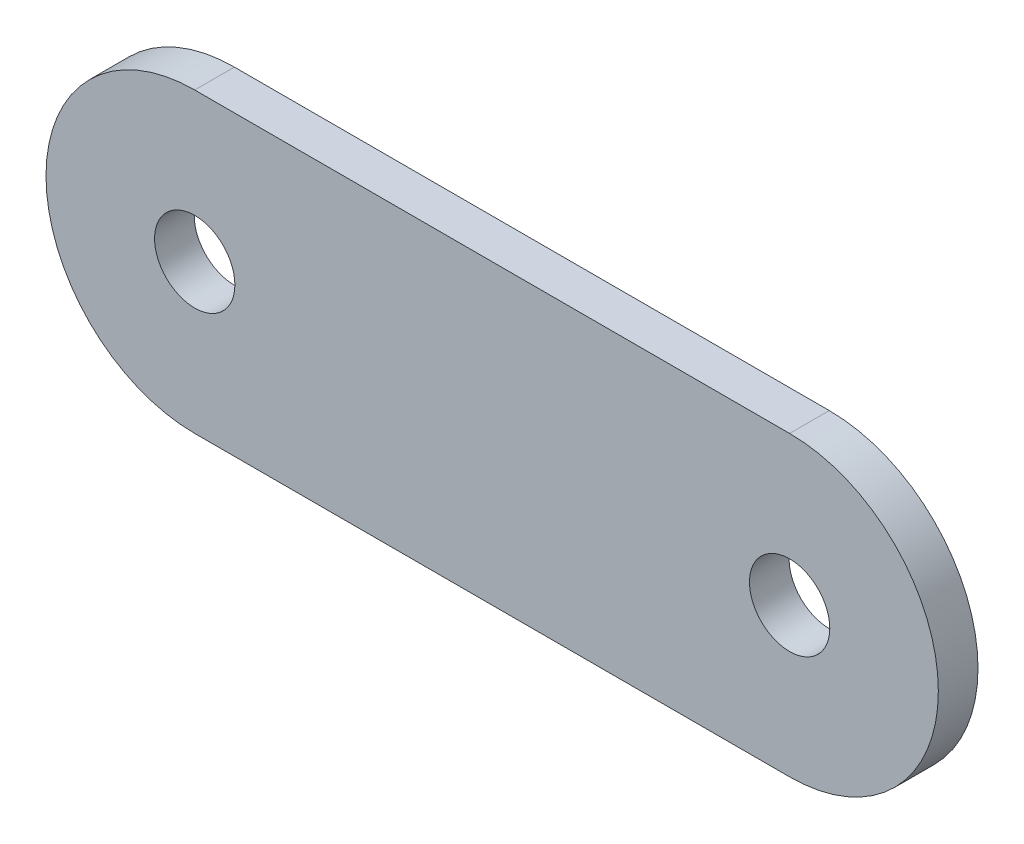
from build123d import *

# Parameters (mm, degrees)
SKETCH1_R           = 4.05
BOSS_EXTRUDE1_DEPTH = 4


with BuildPart() as part:
    # Sketch1 → Boss-Extrude1 (new body)
    with BuildSketch(Plane.XY):
        with BuildLine():
            Line((15, 0), (75, 0))
            ThreePointArc((75, 0), (90, 15), (75, 30))
            Line((75, 30), (15, 30))
            ThreePointArc((15, 30), (0, 15), (15, 0))
        make_face()
        with Locations((15, 15)):
            Circle(SKETCH1_R, mode=Mode.SUBTRACT)
        with Locations((75, 15)):
            Circle(SKETCH1_R, mode=Mode.SUBTRACT)
    extrude(amount=BOSS_EXTRUDE1_DEPTH)


solid = part.part
